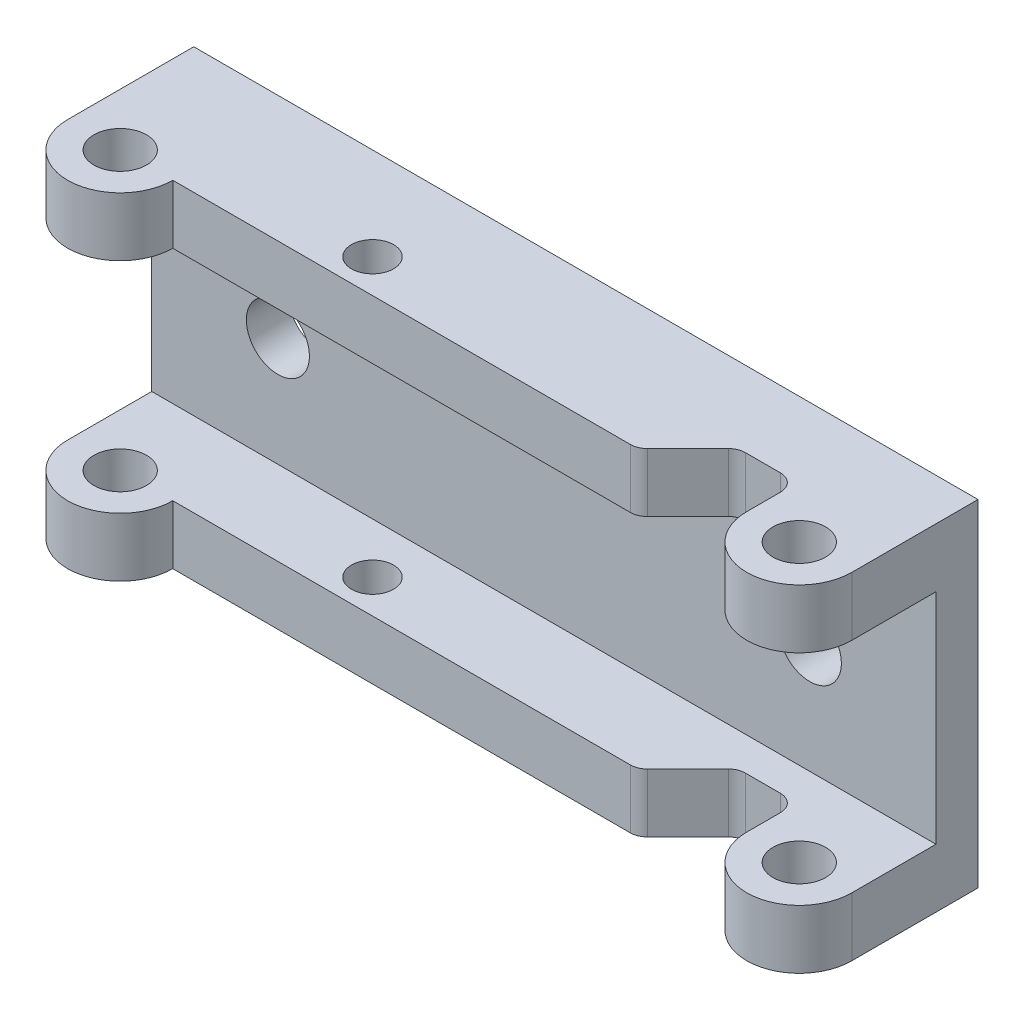
from build123d import *

# Parameters (mm, degrees)
BOSS_EXTRUDE1_DEPTH            = 118.4275
CUT_EXTRUDE1_REACH             = 138.757
SKETCH3_R                      = 3.96875
SKETCH3_R_2                    = 3.175
CUT_EXTRUDE1_DIRECTION_2_REACH = 138.757
SKETCH4_R                      = 4.7625
CUT_EXTRUDE2_DEPTH             = 6.35


with BuildPart() as part:
    # Sketch2 → Boss-Extrude1 (new body)
    with BuildSketch(Plane(origin=(0, 0, 0), x_dir=(0, 0, -1), z_dir=(1, 0, 0))):
        Polygon((0, -25.4), (0, 25.4), (-63.5, 25.4), (-63.5, 16.51), (-6.35, 16.51), (-6.35, -16.51), (-63.5, -16.51), (-63.5, -25.4), align=None)
    extrude(amount=BOSS_EXTRUDE1_DEPTH)

    # Cut-Extrude1: up to this face of the body (flat: up to its plane)
    cut_extrude1_end = Plane(part.part.faces().sort_by_distance((59.21375, -25.4, 31.75))[0])
    # Sketch3 → Cut-Extrude1 (cut, up to the picked face)
    with BuildSketch(Plane(origin=(0, 0, 0), x_dir=(1, 0, 0), z_dir=(0, 1, 0)), mode=Mode.PRIVATE) as cut_extrude1_sk1:
        with Locations(Location((7.9375, -19.05, 0), (0, 0, 270))):
            Circle(SKETCH3_R)
    cut_extrude1_tool1 = split(extrude(cut_extrude1_sk1.sketch, amount=-CUT_EXTRUDE1_REACH, mode=Mode.PRIVATE), bisect_by=cut_extrude1_end, keep=Keep.BOTH, mode=Mode.PRIVATE)
    # Sketch3 → Cut-Extrude1 (cut, up to the picked face)
    with BuildSketch(Plane(origin=(0, 0, 0), x_dir=(1, 0, 0), z_dir=(0, 1, 0)), mode=Mode.PRIVATE) as cut_extrude1_sk2:
        with Locations(Location((110.49, -19.05, 0), (0, 0, 270))):
            Circle(SKETCH3_R)
    cut_extrude1_tool2 = split(extrude(cut_extrude1_sk2.sketch, amount=-CUT_EXTRUDE1_REACH, mode=Mode.PRIVATE), bisect_by=cut_extrude1_end, keep=Keep.BOTH, mode=Mode.PRIVATE)
    # Sketch3 → Cut-Extrude1 (cut, up to the picked face)
    with BuildSketch(Plane(origin=(0, 0, 0), x_dir=(1, 0, 0), z_dir=(0, 1, 0)), mode=Mode.PRIVATE) as cut_extrude1_sk3:
        with Locations(Location((40.9575, -13.97, 0), (0, 0, 270))):
            Circle(SKETCH3_R_2)
    cut_extrude1_tool3 = split(extrude(cut_extrude1_sk3.sketch, amount=-CUT_EXTRUDE1_REACH, mode=Mode.PRIVATE), bisect_by=cut_extrude1_end, keep=Keep.BOTH, mode=Mode.PRIVATE)
    # Sketch3 → Cut-Extrude1 (cut, up to the picked face)
    with BuildSketch(Plane(origin=(0, 0, 0), x_dir=(1, 0, 0), z_dir=(0, 1, 0)), mode=Mode.PRIVATE) as cut_extrude1_sk4:
        with BuildLine():
            Line((0, -63.5), (0, -19.05))
            ThreePointArc((0, -19.05), (7.9375, -26.9875), (15.875, -19.05))
            Line((15.875, -19.05), (84.990397552, -19.05))
            ThreePointArc((84.990397552, -19.05), (85.96241347, -18.856654013), (86.786448776, -18.306051224))
            Line((86.786448776, -18.306051224), (92.918551224, -12.173948776))
            ThreePointArc((92.918551224, -12.173948776), (93.74258653, -11.623345987), (94.714602448, -11.43))
            Line((94.714602448, -11.43), (100.0125, -11.43))
            ThreePointArc((100.0125, -11.43), (101.808551224, -12.173948776), (102.5525, -13.97))
            Line((102.5525, -13.97), (102.5525, -19.05))
            ThreePointArc((102.5525, -19.05), (110.49, -26.9875), (118.4275, -19.05))
            Line((118.4275, -19.05), (118.4275, -63.5))
            Line((118.4275, -63.5), (0, -63.5))
        make_face()
    cut_extrude1_tool4 = split(extrude(cut_extrude1_sk4.sketch, amount=-CUT_EXTRUDE1_REACH, mode=Mode.PRIVATE), bisect_by=cut_extrude1_end, keep=Keep.BOTH, mode=Mode.PRIVATE)
    add(cut_extrude1_tool1.solids().sort_by(Axis((7.9375, 0, 19.05), (0, -1, 0)))[0], mode=Mode.SUBTRACT)
    add(cut_extrude1_tool2.solids().sort_by(Axis((110.49, 0, 19.05), (0, -1, 0)))[0], mode=Mode.SUBTRACT)
    add(cut_extrude1_tool3.solids().sort_by(Axis((40.9575, 0, 13.97), (0, -1, 0)))[0], mode=Mode.SUBTRACT)
    add(cut_extrude1_tool4.solids().sort_by(Axis((59.891999, 0, 41.525151), (0, -1, 0)))[0], mode=Mode.SUBTRACT)

    # Cut-Extrude1 direction 2: up to this face of the body (flat: up to its plane)
    cut_extrude1_direction_2_end = Plane(part.part.faces().sort_by_distance((59.21375, 25.4, 31.75))[0])
    # Sketch3 → Cut-Extrude1 direction 2 (cut, up to the picked face)
    with BuildSketch(Plane(origin=(0, 0, 0), x_dir=(1, 0, 0), z_dir=(0, 1, 0)), mode=Mode.PRIVATE) as cut_extrude1_direction_2_sk1:
        with Locations(Location((7.9375, -19.05, 0), (0, 0, 270))):
            Circle(SKETCH3_R)
    cut_extrude1_direction_2_tool1 = split(extrude(cut_extrude1_direction_2_sk1.sketch, amount=CUT_EXTRUDE1_DIRECTION_2_REACH, mode=Mode.PRIVATE), bisect_by=cut_extrude1_direction_2_end, keep=Keep.BOTH, mode=Mode.PRIVATE)
    # Sketch3 → Cut-Extrude1 direction 2 (cut, up to the picked face)
    with BuildSketch(Plane(origin=(0, 0, 0), x_dir=(1, 0, 0), z_dir=(0, 1, 0)), mode=Mode.PRIVATE) as cut_extrude1_direction_2_sk2:
        with Locations(Location((110.49, -19.05, 0), (0, 0, 270))):
            Circle(SKETCH3_R)
    cut_extrude1_direction_2_tool2 = split(extrude(cut_extrude1_direction_2_sk2.sketch, amount=CUT_EXTRUDE1_DIRECTION_2_REACH, mode=Mode.PRIVATE), bisect_by=cut_extrude1_direction_2_end, keep=Keep.BOTH, mode=Mode.PRIVATE)
    # Sketch3 → Cut-Extrude1 direction 2 (cut, up to the picked face)
    with BuildSketch(Plane(origin=(0, 0, 0), x_dir=(1, 0, 0), z_dir=(0, 1, 0)), mode=Mode.PRIVATE) as cut_extrude1_direction_2_sk3:
        with Locations(Location((40.9575, -13.97, 0), (0, 0, 270))):
            Circle(SKETCH3_R_2)
    cut_extrude1_direction_2_tool3 = split(extrude(cut_extrude1_direction_2_sk3.sketch, amount=CUT_EXTRUDE1_DIRECTION_2_REACH, mode=Mode.PRIVATE), bisect_by=cut_extrude1_direction_2_end, keep=Keep.BOTH, mode=Mode.PRIVATE)
    # Sketch3 → Cut-Extrude1 direction 2 (cut, up to the picked face)
    with BuildSketch(Plane(origin=(0, 0, 0), x_dir=(1, 0, 0), z_dir=(0, 1, 0)), mode=Mode.PRIVATE) as cut_extrude1_direction_2_sk4:
        with BuildLine():
            Line((0, -63.5), (0, -19.05))
            ThreePointArc((0, -19.05), (7.9375, -26.9875), (15.875, -19.05))
            Line((15.875, -19.05), (84.990397552, -19.05))
            ThreePointArc((84.990397552, -19.05), (85.96241347, -18.856654013), (86.786448776, -18.306051224))
            Line((86.786448776, -18.306051224), (92.918551224, -12.173948776))
            ThreePointArc((92.918551224, -12.173948776), (93.74258653, -11.623345987), (94.714602448, -11.43))
            Line((94.714602448, -11.43), (100.0125, -11.43))
            ThreePointArc((100.0125, -11.43), (101.808551224, -12.173948776), (102.5525, -13.97))
            Line((102.5525, -13.97), (102.5525, -19.05))
            ThreePointArc((102.5525, -19.05), (110.49, -26.9875), (118.4275, -19.05))
            Line((118.4275, -19.05), (118.4275, -63.5))
            Line((118.4275, -63.5), (0, -63.5))
        make_face()
    cut_extrude1_direction_2_tool4 = split(extrude(cut_extrude1_direction_2_sk4.sketch, amount=CUT_EXTRUDE1_DIRECTION_2_REACH, mode=Mode.PRIVATE), bisect_by=cut_extrude1_direction_2_end, keep=Keep.BOTH, mode=Mode.PRIVATE)
    add(cut_extrude1_direction_2_tool1.solids().sort_by(Axis((7.9375, 0, 19.05), (0, 1, 0)))[0], mode=Mode.SUBTRACT)
    add(cut_extrude1_direction_2_tool2.solids().sort_by(Axis((110.49, 0, 19.05), (0, 1, 0)))[0], mode=Mode.SUBTRACT)
    add(cut_extrude1_direction_2_tool3.solids().sort_by(Axis((40.9575, 0, 13.97), (0, 1, 0)))[0], mode=Mode.SUBTRACT)
    add(cut_extrude1_direction_2_tool4.solids().sort_by(Axis((59.891999, 0, 41.525151), (0, 1, 0)))[0], mode=Mode.SUBTRACT)

    # Sketch4 → Cut-Extrude2 (cut)
    with BuildSketch(Plane.XY):
        with Locations(Location((19.05, 0, 0), (0, 0, 180))):
            Circle(SKETCH4_R)
        with Locations(Location((99.3775, 0, 0), (0, 0, 180))):
            Circle(SKETCH4_R)
    extrude(amount=CUT_EXTRUDE2_DEPTH, mode=Mode.SUBTRACT)


solid = part.part
